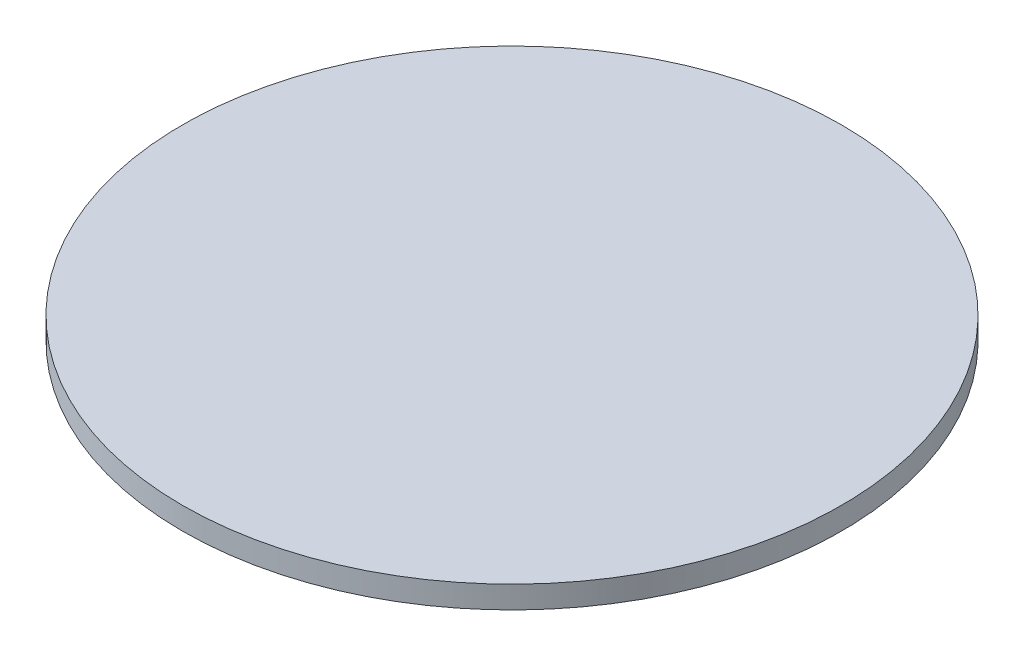
from build123d import *

# Parameters (mm, degrees)
SKETCH1_R           = 118
BOSS_EXTRUDE1_DEPTH = 8


with BuildPart() as part:
    # Sketch1 → Boss-Extrude1 (new body)
    with BuildSketch(Plane(origin=(0, 0, 0), x_dir=(1, 0, 0), z_dir=(0, 1, 0))):
        with Locations(Location((0, 0, 0), (0, 0, 270))):
            Circle(SKETCH1_R)
    extrude(amount=BOSS_EXTRUDE1_DEPTH)


solid = part.part
